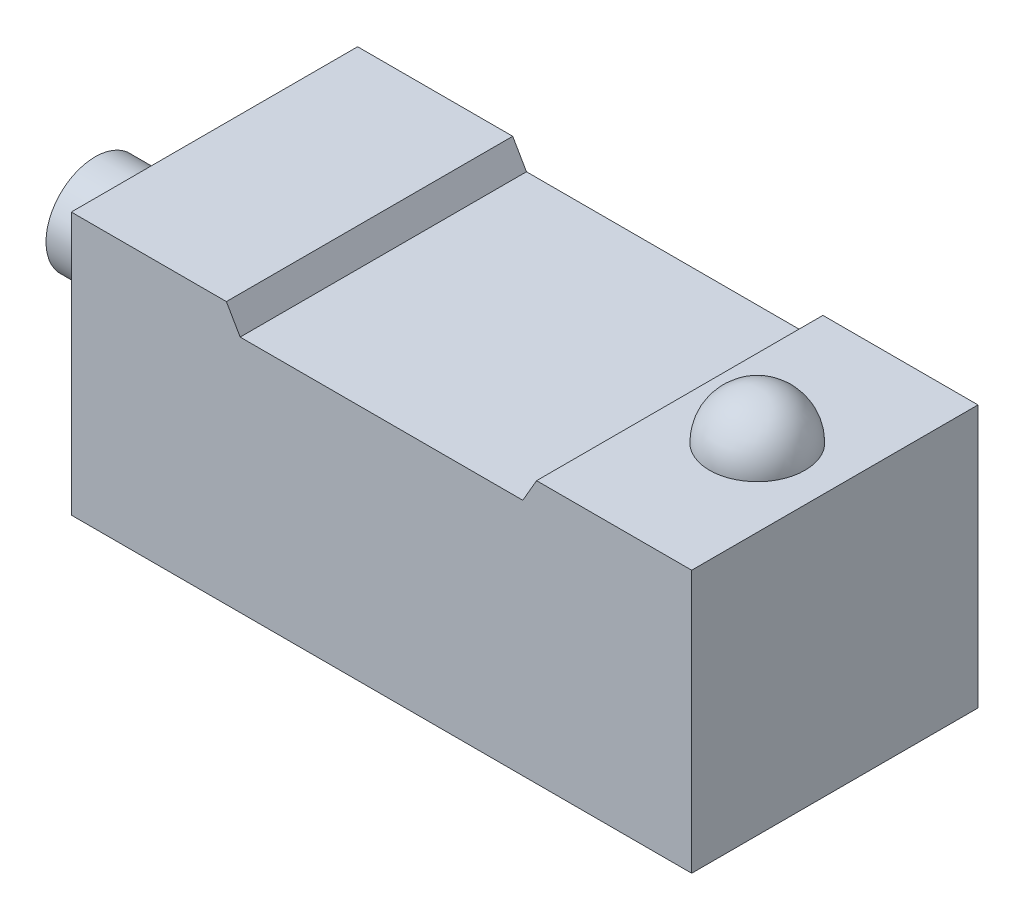
from build123d import *

# Parameters (mm, degrees)
SKETCH_1_W          = 26
SKETCH_1_H          = 12
EXTRUDE_1_DEPTH     = 11
SKETCH_2_W          = 13
SKETCH_2_H          = 15
CUT_EXTRUDE_2_DEPTH = 1
CUT_EXTRUDE_2_DRAFT = -30
SKETCH_4_R          = 2.060062992
EXTRUDE_3_DEPTH     = 5


with BuildPart() as part:
    # 草图1 → 拉伸1 (new body)
    with BuildSketch(Plane(origin=(0, 0, 0), x_dir=(1, 0, 0), z_dir=(0, 1, 0))):
        Rectangle(SKETCH_1_W, SKETCH_1_H)
    extrude(amount=EXTRUDE_1_DEPTH)


with BuildPart() as cut_extrude_2_tool:
    # 草图2 → 拉伸2 (with draft: the straight prism first)
    with BuildSketch(Plane(origin=(0, 11, 0), x_dir=(1, 0, 0), z_dir=(0, 1, 0))):
        Rectangle(SKETCH_2_W, SKETCH_2_H)
    extrude(amount=-CUT_EXTRUDE_2_DEPTH)
    # 拉伸2: the draft: its side faces are tilted about the plane it starts from
    cut_extrude_2_sides = [cut_extrude_2_tool.faces().sort_by_distance(p)[0] for p in [
        (0, 10.5, 7.5),
        (6.5, 10.5, 0),
        (0, 10.5, -7.5),
        (-6.5, 10.5, 0),
    ]]
    draft(cut_extrude_2_sides, Plane(origin=(0, 11, 0), x_dir=(1, 0, 0), z_dir=(0, 1, 0)), CUT_EXTRUDE_2_DRAFT)


with BuildPart() as part_1:
    add(part.part)

    # 拉伸2: cut by cut_extrude_2_tool
    add(cut_extrude_2_tool.part, mode=Mode.SUBTRACT)

    # 草图3 → 旋转1 (revolve)
    with BuildSketch(Plane.XY):
        with BuildLine():
            Line((9.75, 13), (9.75, 9))
            ThreePointArc((9.75, 9), (11.75, 11), (9.75, 13))
        make_face()
    revolve(axis=Axis((9.75, 13, 0), (0, -1, 0)))

    # 草图4 → 拉伸3 (add)
    with BuildSketch(Plane.ZY.offset(13)):
        with Locations(Location((0, 5.445496221, 0), (0, 0, 180))):
            Circle(SKETCH_4_R)
    extrude(amount=EXTRUDE_3_DEPTH)


solid = part_1.part
